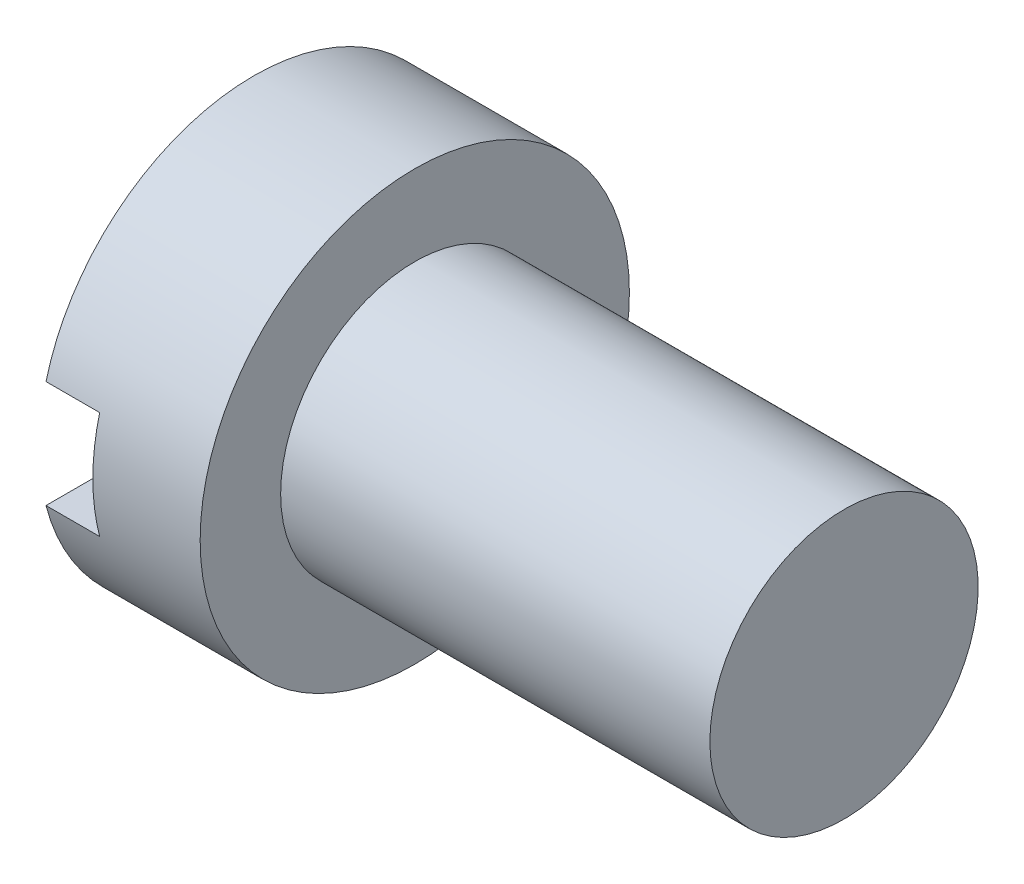
from build123d import *

# Parameters (mm, degrees)
CUT_EXTRUDE_2_DEPTH = 0.5


with BuildPart() as part:
    # Эскиз2 → Повернуть1 (revolve)
    with BuildSketch(Plane(origin=(0, 0, 0), x_dir=(1, 0, 0), z_dir=(0, 1, 0))):
        Polygon((0, 2), (0, 0), (5.5, 0), (5.5, 1.25), (1.5, 1.25), (1.5, 2), align=None)
    revolve(axis=Axis((0, 0, 0), (1, 0, 0)))

    # Эскиз3 → Вырез-Вытянуть2 (cut)
    with BuildSketch(Plane.ZY):
        with BuildLine():
            ThreePointArc((-1.936491673, 0.5), (-2, 0), (-1.936491673, -0.5))
            Line((-1.936491673, -0.5), (1.936491673, -0.5))
            ThreePointArc((1.936491673, -0.5), (1.984059393, -0.252008585), (2, 0))
            ThreePointArc((2, 0), (1.984059393, 0.252008585), (1.936491673, 0.5))
            Line((1.936491673, 0.5), (-1.936491673, 0.5))
        make_face()
    extrude(amount=-CUT_EXTRUDE_2_DEPTH, mode=Mode.SUBTRACT)


solid = part.part
